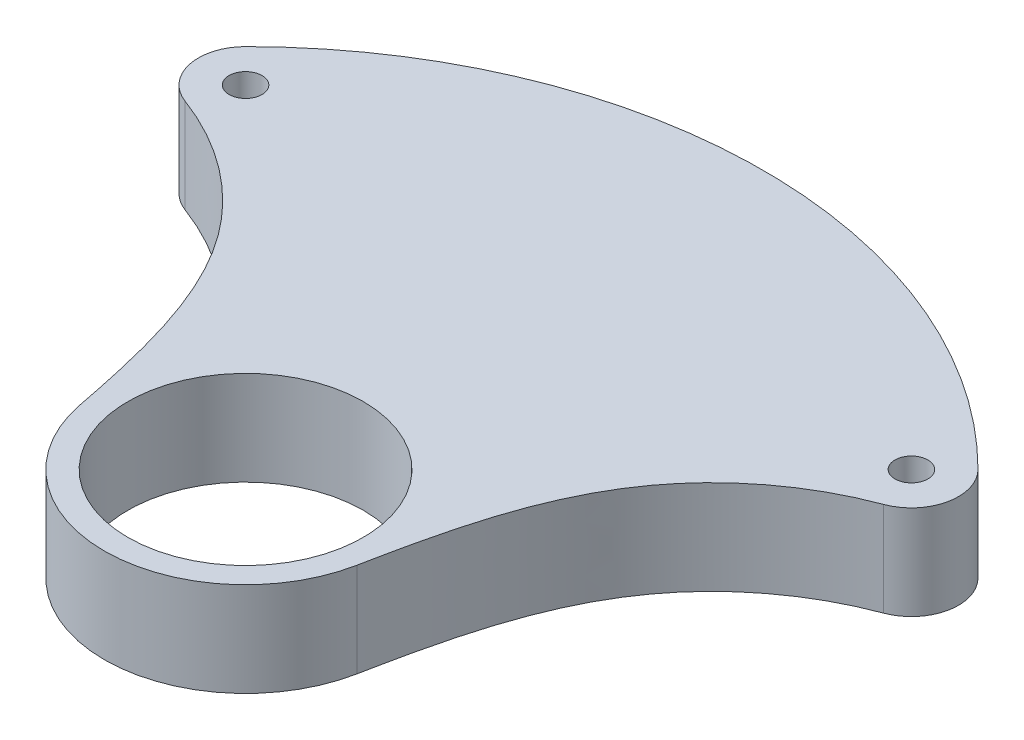
from build123d import *

# Parameters (mm, degrees)
SKETCH2_R           = 12.5
BOSS_EXTRUDE1_DEPTH = 10
CUT_EXTRUDE1_REACH  = 70.946
SKETCH3_R           = 1.75


with BuildPart() as part:
    # Sketch2 → Boss-Extrude1 (new body)
    # profile 1 of 6: a face of its own
    with BuildSketch(Plane(origin=(0, 0, 0), x_dir=(1, 0, 0), z_dir=(0, 1, 0))):
        with BuildLine():
            ThreePointArc((-37.10126952, 30.670072063), (-34.291787618, 30.469762498), (-31.819805153, 31.819805153))
            Line((-31.819805153, 31.819805153), (-38.890872965, 38.890872965))
            ThreePointArc((-38.890872965, 38.890872965), (-40.24091562, 34.291787618), (-37.10126952, 30.670072063))
        make_face()
    # profile 2 of 6: a face of its own
    with BuildSketch(Plane(origin=(0, 0, 0), x_dir=(1, 0, 0), z_dir=(0, 1, 0))):
        with BuildLine():
            Line((-38.890872965, 38.890872965), (-31.819805153, 31.819805153))
            ThreePointArc((-31.819805153, 31.819805153), (0, 45), (31.819805153, 31.819805153))
            ThreePointArc((31.819805153, 31.819805153), (34.291787618, 30.469762498), (37.10126952, 30.670072063))
            ThreePointArc((37.10126952, 30.670072063), (40.24091562, 34.291787618), (38.890872965, 38.890872965))
            ThreePointArc((38.890872965, 38.890872965), (0, 55), (-38.890872965, 38.890872965))
        make_face()
    # profile 3 of 6: a face of its own
    with BuildSketch(Plane(origin=(0, 0, 0), x_dir=(1, 0, 0), z_dir=(0, 1, 0))):
        with BuildLine():
            ThreePointArc((31.819805153, 31.819805153), (0, 45), (-31.819805153, 31.819805153))
            ThreePointArc((-31.819805153, 31.819805153), (-32.980343293, 30.615305915), (-34.095316977, 29.36850967))
            add(Edge.make_bspline(
                [(-34.095316977, 29.36850967), (-29.441590917, 27.058917347), (-19.298330582, 18.296119977), (-16.300608859, 5.155248945), (-14.718272731, -2.893518242)],
                knots=[0.074521653, 0.074521653, 0.074521653, 0.074521653, 0.431745363, 1, 1, 1, 1], degree=3))
            ThreePointArc((-14.718272731, -2.893518242), (-1.453600536, 14.929402047), (15, 0))
            ThreePointArc((15, 0), (14.929402047, -1.453600536), (14.718272731, -2.893518242))
            add(Edge.make_bspline(
                [(34.095316977, 29.36850967), (29.441590917, 27.058917347), (19.298330582, 18.296119977), (16.300608859, 5.155248945), (14.718272731, -2.893518242)],
                knots=[0.074521653, 0.074521653, 0.074521653, 0.074521653, 0.431745363, 1, 1, 1, 1], degree=3))
            ThreePointArc((34.095316977, 29.36850967), (32.980343293, 30.615305915), (31.819805153, 31.819805153))
        make_face()
    # profile 4 of 6: a face of its own
    with BuildSketch(Plane(origin=(0, 0, 0), x_dir=(1, 0, 0), z_dir=(0, 1, 0))):
        with BuildLine():
            ThreePointArc((-34.095316977, 29.36850967), (-32.980343293, 30.615305915), (-31.819805153, 31.819805153))
            ThreePointArc((-31.819805153, 31.819805153), (-34.291787618, 30.469762498), (-37.10126952, 30.670072063))
            add(Edge.make_bspline(
                [(-37.10126952, 30.670072063), (-36.069117472, 30.285448156), (-35.066146599, 29.85032158), (-34.095316977, 29.36850967)],
                knots=[0, 0, 0, 0, 0.074521653, 0.074521653, 0.074521653, 0.074521653], degree=3))
        make_face()
    # profile 5 of 6: a face of its own
    with BuildSketch(Plane(origin=(0, 0, 0), x_dir=(1, 0, 0), z_dir=(0, 1, 0))):
        with BuildLine():
            ThreePointArc((37.10126952, 30.670072063), (34.291787618, 30.469762498), (31.819805153, 31.819805153))
            ThreePointArc((31.819805153, 31.819805153), (32.980343293, 30.615305915), (34.095316977, 29.36850967))
            add(Edge.make_bspline(
                [(37.10126952, 30.670072063), (36.069117472, 30.285448156), (35.066146599, 29.85032158), (34.095316977, 29.36850967)],
                knots=[0, 0, 0, 0, 0.074521653, 0.074521653, 0.074521653, 0.074521653], degree=3))
        make_face()
    # profile 6 of 6: a face of its own
    with BuildSketch(Plane(origin=(0, 0, 0), x_dir=(1, 0, 0), z_dir=(0, 1, 0))):
        with BuildLine():
            ThreePointArc((15, 0), (-1.453600536, 14.929402047), (-14.718272731, -2.893518242))
            ThreePointArc((-14.718272731, -2.893518242), (0, -15), (14.718272731, -2.893518242))
            ThreePointArc((14.718272731, -2.893518242), (14.929402047, -1.453600536), (15, 0))
        make_face()
        with Locations(Location((0, 0, 0), (0, 0, 270))):
            Circle(SKETCH2_R, mode=Mode.SUBTRACT)
    extrude(amount=BOSS_EXTRUDE1_DEPTH)

    # Sketch3 → Cut-Extrude1 (cut, up to next)
    with BuildSketch(Plane(origin=(0, 10, 0), x_dir=(1, 0, 0), z_dir=(0, 1, 0)), mode=Mode.PRIVATE) as cut_extrude1_sk1:
        with Locations(Location((-35.355339059, 35.355339059, 0), (0, 0, 270))):
            Circle(SKETCH3_R)
    cut_extrude1_tool1 = extrude(cut_extrude1_sk1.sketch, amount=-CUT_EXTRUDE1_REACH, mode=Mode.PRIVATE) & part.part
    # Sketch3 → Cut-Extrude1 (cut, up to next)
    with BuildSketch(Plane(origin=(0, 10, 0), x_dir=(1, 0, 0), z_dir=(0, 1, 0)), mode=Mode.PRIVATE) as cut_extrude1_sk2:
        with Locations(Location((35.355339059, 35.355339059, 0), (0, 0, 270))):
            Circle(SKETCH3_R)
    cut_extrude1_tool2 = extrude(cut_extrude1_sk2.sketch, amount=-CUT_EXTRUDE1_REACH, mode=Mode.PRIVATE) & part.part
    add(cut_extrude1_tool1.solids().sort_by_distance((-35.355339, 10, -35.355339))[0], mode=Mode.SUBTRACT)
    add(cut_extrude1_tool2.solids().sort_by_distance((35.355339, 10, -35.355339))[0], mode=Mode.SUBTRACT)


solid = part.part
